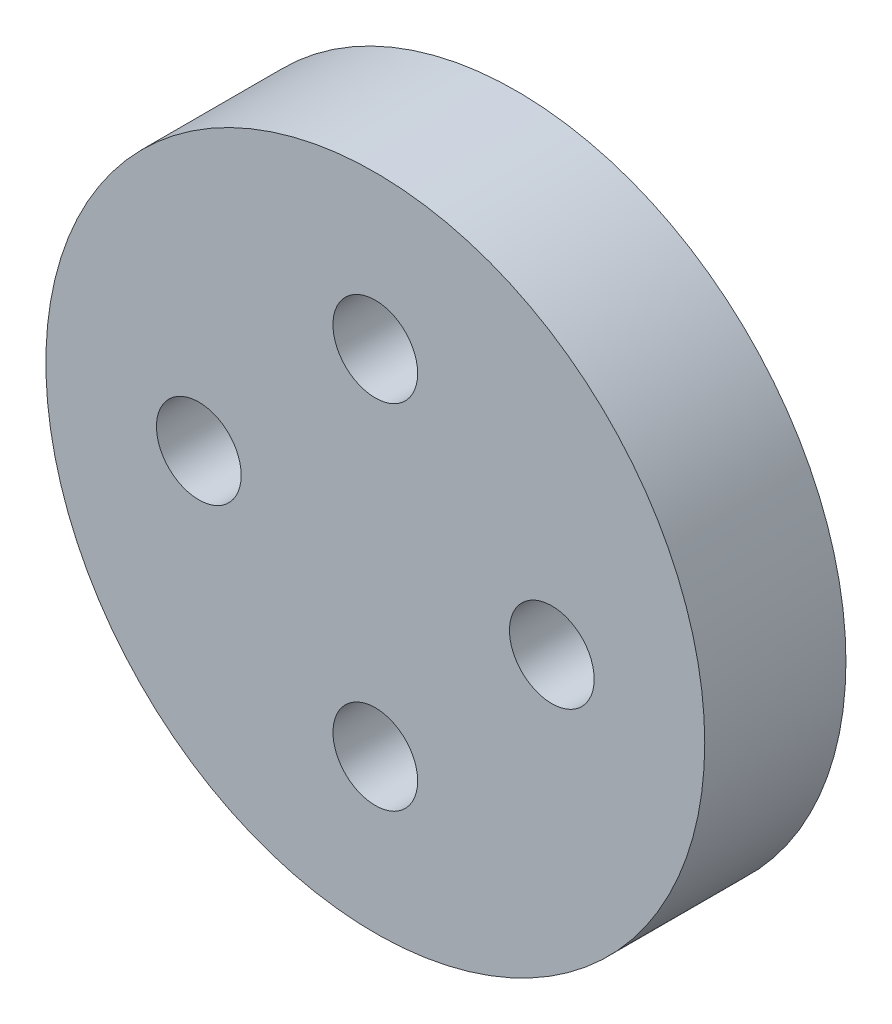
from build123d import *

# Parameters (mm, degrees)
SKETCH1_R           = 7
SKETCH1_R_2         = 0.9
BOSS_EXTRUDE1_DEPTH = 3


with BuildPart() as part:
    # Sketch1 → Boss-Extrude1 (new body)
    with BuildSketch(Plane.XY):
        Circle(SKETCH1_R)
        with Locations((-3.75, 0)):
            Circle(SKETCH1_R_2, mode=Mode.SUBTRACT)
        with Locations((0, -3.75)):
            Circle(SKETCH1_R_2, mode=Mode.SUBTRACT)
        with Locations((0, 3.75)):
            Circle(SKETCH1_R_2, mode=Mode.SUBTRACT)
        with Locations((3.75, 0)):
            Circle(SKETCH1_R_2, mode=Mode.SUBTRACT)
    extrude(amount=BOSS_EXTRUDE1_DEPTH)


solid = part.part
